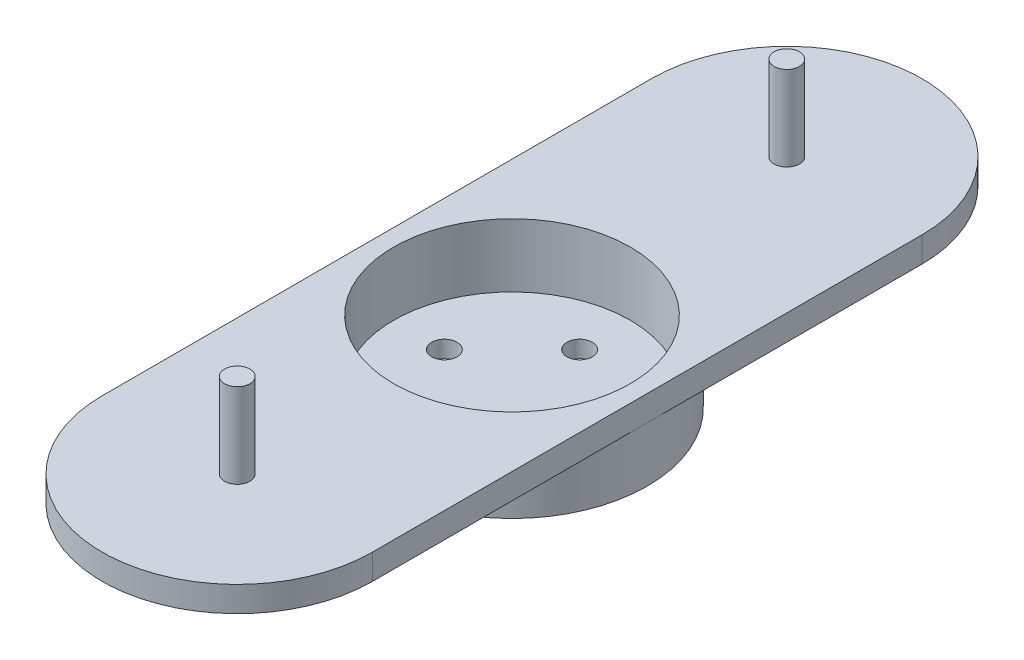
from build123d import *

# Parameters (mm, degrees)
SKETCH1_R           = 16
BOSS_EXTRUDE1_DEPTH = 6.5
BOSS_EXTRUDE2_DEPTH = 3
SKETCH3_R           = 1.5
BOSS_EXTRUDE3_DEPTH = 10
SKETCH4_R           = 14
CUT_EXTRUDE1_DEPTH  = 7.5
SKETCH5_R           = 1.5
CUT_EXTRUDE2_DEPTH  = 54.986109325


with BuildPart() as part:
    # Sketch1 → Boss-Extrude1 (new body)
    with BuildSketch(Plane(origin=(0, 0, 0), x_dir=(1, 0, 0), z_dir=(0, 1, 0))):
        with Locations(Location((0, 0, 0), (0, 0, 90))):
            Circle(SKETCH1_R)
    extrude(amount=BOSS_EXTRUDE1_DEPTH)

    # Sketch2 → Boss-Extrude2 (add)
    with BuildSketch(Plane(origin=(0, 6.5, 0), x_dir=(1, 0, 0), z_dir=(0, 1, 0))):
        with BuildLine():
            Line((-16, -32.5), (-16, 32.5))
            ThreePointArc((-16, 32.5), (0, 48.5), (16, 32.5))
            Line((16, 32.5), (16, -32.5))
            ThreePointArc((16, -32.5), (0, -48.5), (-16, -32.5))
        make_face()
    extrude(amount=BOSS_EXTRUDE2_DEPTH)

    # Sketch3 → Boss-Extrude3 (add)
    with BuildSketch(Plane(origin=(0, 9.5, 0), x_dir=(1, 0, 0), z_dir=(0, 1, 0))):
        with Locations(Location((0, 32.5, 0), (0, 0, 270))):
            Circle(SKETCH3_R)
        with Locations(Location((0, -32.5, 0), (0, 0, 270))):
            Circle(SKETCH3_R)
    extrude(amount=BOSS_EXTRUDE3_DEPTH)

    # Sketch4 → Cut-Extrude1 (cut)
    with BuildSketch(Plane(origin=(0, 9.5, 0), x_dir=(1, 0, 0), z_dir=(0, 1, 0))):
        with Locations(Location((0, 0, 0), (0, 0, 270))):
            Circle(SKETCH4_R)
    extrude(amount=-CUT_EXTRUDE1_DEPTH, mode=Mode.SUBTRACT)

    # Sketch5 → Cut-Extrude2 (cut, through all)
    with BuildSketch(Plane(origin=(0, 2, 0), x_dir=(1, 0, 0), z_dir=(0, 1, 0))):
        with Locations(Location((8, 0, 0), (0, 0, 270))):
            Circle(SKETCH5_R)
        with Locations(Location((0, -8, 0), (0, 0, 270))):
            Circle(SKETCH5_R)
        with Locations(Location((-8, 0, 0), (0, 0, 270))):
            Circle(SKETCH5_R)
        with Locations(Location((0, 8, 0), (0, 0, 270))):
            Circle(SKETCH5_R)
    extrude(amount=-CUT_EXTRUDE2_DEPTH, mode=Mode.SUBTRACT)


solid = part.part
